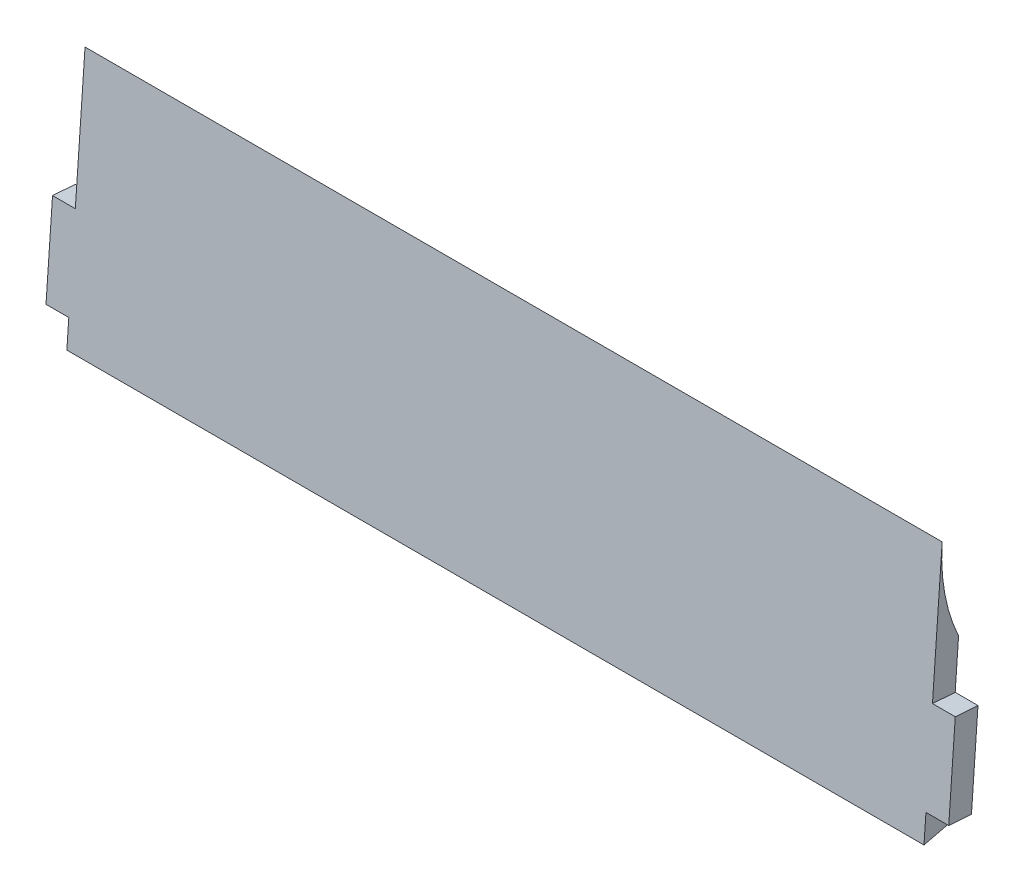
from build123d import *

# Parameters (mm, degrees)
BOSS_EXTRUDE1_DEPTH = 59.69
SKETCH2_W           = 1.5875
SKETCH2_H           = 6.35
BOSS_EXTRUDE2_DEPTH = 1.5875


with BuildPart() as part:
    # Sketch1 → Boss-Extrude1 (new body)
    with BuildSketch(Plane(origin=(0, 0, 0), x_dir=(0, 0, -1), z_dir=(1, 0, 0))):
        with BuildLine():
            Line((0.590873303, -4.466173809), (0.136355378, -10.799886264))
            Line((0.136355378, -10.799886264), (0, -12.7))
            Line((0, -12.7), (1.619880116, -12.30567041))
            Line((1.619880116, -12.30567041), (2.174301417, -4.579803291))
            Line((2.174301417, -4.579803291), (2.409882648, -1.296976159))
            ThreePointArc((2.409882648, -1.296976159), (1.441524141, 1.753522136), (1.266539623, 4.949244036))
            Line((1.266539623, 4.949244036), (0.590873303, -4.466173809))
        make_face()
    extrude(amount=BOSS_EXTRUDE1_DEPTH)

    # Sketch2 → Boss-Extrude2 (add)
    with BuildSketch(Plane(origin=(0, -0.065066628, -0.906704203), x_dir=(1, 0, 0), z_dir=(0, 0.07157762605528778, 0.9974350321942224))):
        with Locations((-0.79375, -7.587424909)):
            Rectangle(SKETCH2_W, SKETCH2_H)
        with Locations((60.48375, -7.587424909)):
            Rectangle(SKETCH2_W, SKETCH2_H)
    extrude(amount=-BOSS_EXTRUDE2_DEPTH)


solid = part.part
